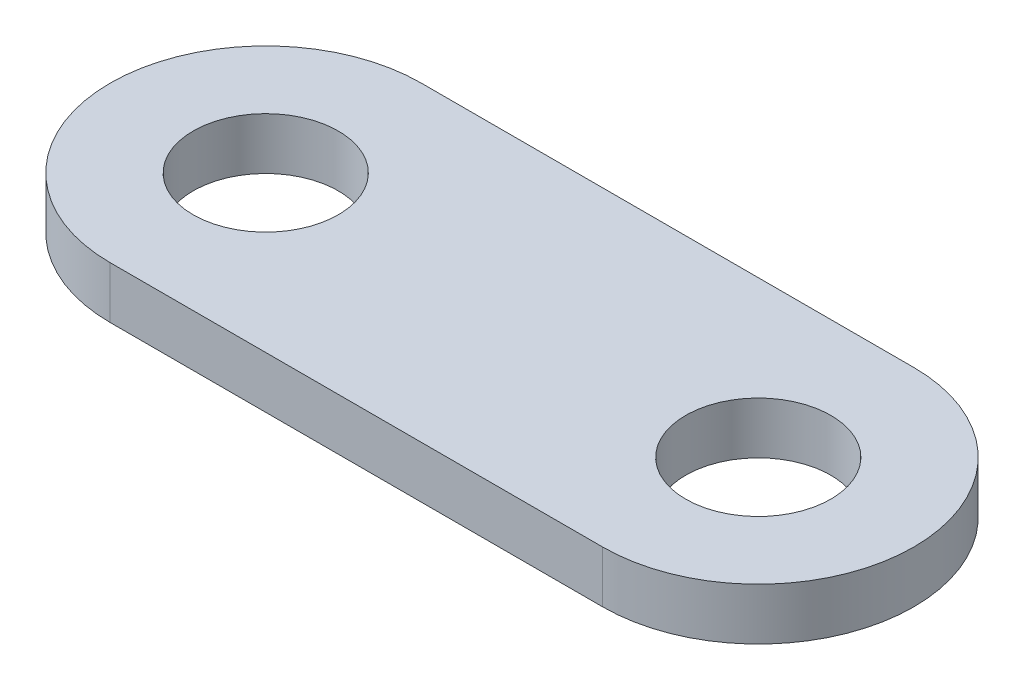
from build123d import *

# Parameters (mm, degrees)
SKETCH1_R           = 7
BOSS_EXTRUDE1_DEPTH = 5


with BuildPart() as part:
    # Sketch1 → Boss-Extrude1 (new body)
    with BuildSketch(Plane(origin=(0, 0, 0), x_dir=(1, 0, 0), z_dir=(0, 1, 0))):
        with BuildLine():
            Line((-23.75, 15), (23.75, 15))
            ThreePointArc((23.75, 15), (38.75, 0), (23.75, -15))
            Line((23.75, -15), (-23.75, -15))
            ThreePointArc((-23.75, -15), (-38.75, 0), (-23.75, 15))
        make_face()
        with Locations(Location((-23.75, 0, 0), (0, 0, 270))):
            Circle(SKETCH1_R, mode=Mode.SUBTRACT)
        with Locations(Location((23.75, 0, 0), (0, 0, 270))):
            Circle(SKETCH1_R, mode=Mode.SUBTRACT)
    extrude(amount=BOSS_EXTRUDE1_DEPTH)


solid = part.part
